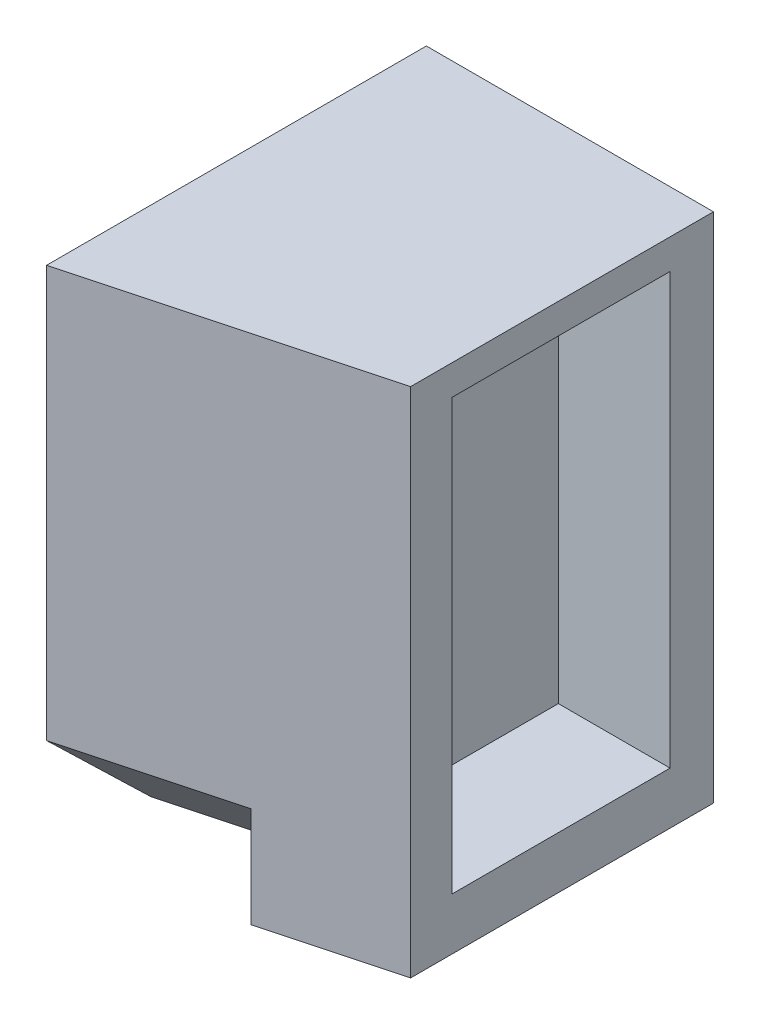
from build123d import *

# Parameters (mm, degrees)
BOSS_EXTRUDE1_DEPTH = 582.222564
SKETCH3_W           = 247.65
SKETCH3_H           = 488.95
CUT_EXTRUDE1_DEPTH  = 127
SKETCH4_W           = 200
SKETCH4_H           = 250
CUT_EXTRUDE2_DEPTH  = 100
SKETCH5_W           = 100
SKETCH5_H           = 100
CUT_EXTRUDE3_DEPTH  = 100
CUT_EXTRUDE4_DEPTH  = 172
CUT_EXTRUDE5_DEPTH  = 190


with BuildPart() as part:
    # Sketch2 → Boss-Extrude1 (new body)
    with BuildSketch(Plane(origin=(0, 0, 0), x_dir=(1, 0, 0), z_dir=(0, 1, 0))):
        Polygon((0, -431.8), (326.398993941, -344.341653163), (326.398993941, 0), (0, 0), align=None)
    extrude(amount=BOSS_EXTRUDE1_DEPTH)

    # Sketch3 → Cut-Extrude1 (cut)
    with BuildSketch(Plane(origin=(326.398993941, 0, 0), x_dir=(0, 0, -1), z_dir=(1, 0, 0))):
        with Locations((-173.171445322, 303.629475409)):
            Rectangle(SKETCH3_W, SKETCH3_H)
    extrude(amount=-CUT_EXTRUDE1_DEPTH, mode=Mode.SUBTRACT)

    # Sketch4 → Cut-Extrude2 (cut)
    with BuildSketch(Plane(origin=(0, 0, 0), x_dir=(0, -1, 0), z_dir=(1, 0, 0))):
        with Locations((-209.55, -215.9)):
            Rectangle(SKETCH4_W, SKETCH4_H)
    extrude(amount=CUT_EXTRUDE2_DEPTH, mode=Mode.SUBTRACT)

    # Sketch5 → Cut-Extrude3 (cut)
    with BuildSketch(Plane.ZY):
        with Locations((215.9, 488.315)):
            Rectangle(SKETCH5_W, SKETCH5_H)
    extrude(amount=-CUT_EXTRUDE3_DEPTH, mode=Mode.SUBTRACT)

    # Sketch6 → Cut-Extrude4 (cut)
    with BuildSketch(Plane.ZY):
        Polygon((0, 114.3), (114.3, 0), (0, 0), align=None)
    extrude(amount=-CUT_EXTRUDE4_DEPTH, mode=Mode.SUBTRACT)

    # Sketch7 → Cut-Extrude5 (cut)
    with BuildSketch(Plane(origin=(-107.95, 0, 28.925115323), x_dir=(0, 1, 0), z_dir=(0.9659258262890691, 0, -0.25881904510251796))):
        Polygon((0, 417.086771792), (114.3, 417.086771792), (0, 302.786771792), align=None)
    extrude(amount=CUT_EXTRUDE5_DEPTH, mode=Mode.SUBTRACT)


solid = part.part
